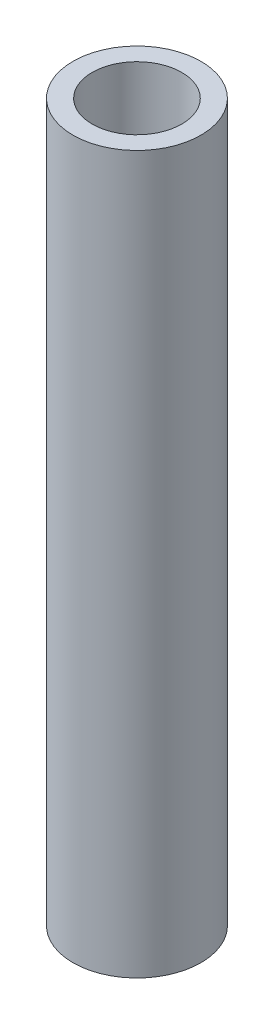
from build123d import *

# Parameters (mm, degrees)
SKETCH1_R           = 2.5
SKETCH1_R_2         = 1.75
BOSS_EXTRUDE1_DEPTH = 28


with BuildPart() as part:
    # Sketch1 → Boss-Extrude1 (new body)
    with BuildSketch(Plane(origin=(0, 0, 0), x_dir=(1, 0, 0), z_dir=(0, 1, 0))):
        with Locations(Location((-1.445842726, 0.184306801, 0), (0, 0, 270))):
            Circle(SKETCH1_R)
        with Locations(Location((-1.445842726, 0.184306801, 0), (0, 0, 270))):
            Circle(SKETCH1_R_2, mode=Mode.SUBTRACT)
    extrude(amount=BOSS_EXTRUDE1_DEPTH)


solid = part.part
